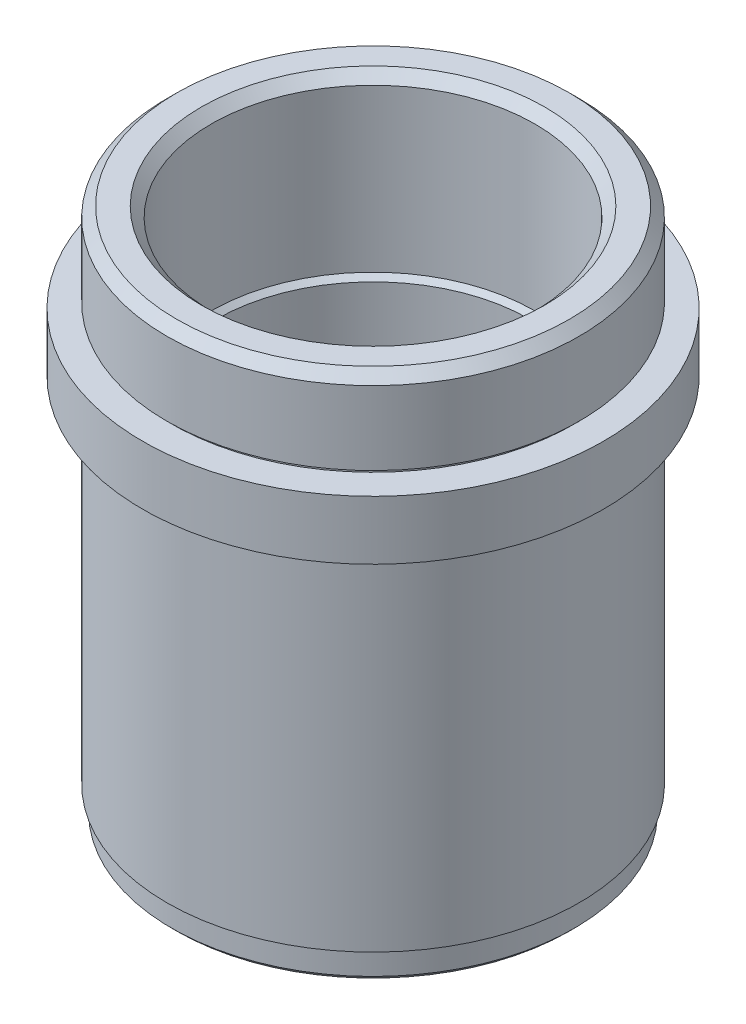
from build123d import *


with BuildPart() as part:
    # Szkic1 → Obrót1 (revolve)
    with BuildSketch(Plane.XY, mode=Mode.PRIVATE) as obr_t1_sk:
        Polygon((-17.5, 59.995363569), (-20, 59.995363569), (-21, 58.995363569), (-21, 51.5), (-20.5, 51.5), (-20.5, 50.995363569), (-23.5, 50.995363569), (-23.5, 44.995363569), (-20.5, 44.995363569), (-20.5, 44.5), (-21, 44.5), (-21, 8.995363569), (-20.5, 8.995363569), (-20.5, 6.495363569), (-20, 5.995363569), (-16, 5.995363569), (-16, 41.995363569), (-16.5, 42.495363569), (-16.5, 58.995363569), align=None)
    revolve(obr_t1_sk.sketch.rotate(Axis((0, 0, 0), (0, 1, 0)), 270), axis=Axis((0, 0, 0), (0, 1, 0)))


solid = part.part
